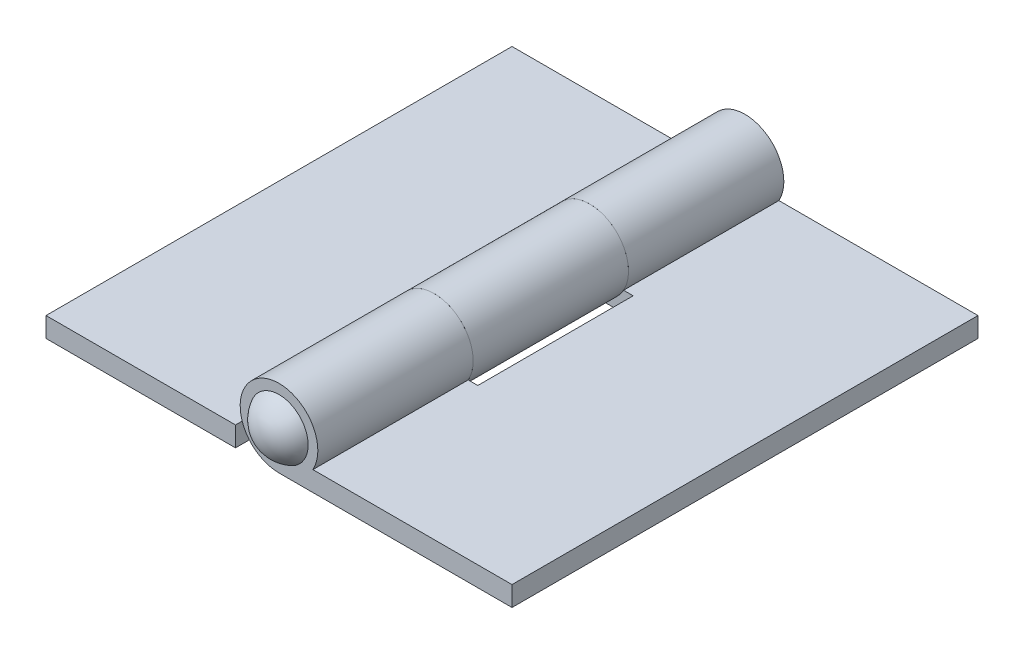
from build123d import *

# Parameters (mm, degrees)
SKETCH1_R           = 1.5875
EXTRUDE1_DEPTH      = 19.05
SKETCH1_W           = 15.494
SKETCH1_H           = 1.6256
EXTRUDE1_2_DEPTH    = 19.05
EXTRUDE4_DEPTH      = 29.173887468
EXTRUDE4_DEPTH_BACK = 29.173887468
SKETCH8_W           = 7.112
SKETCH8_H           = 12.7
SKETCH9_R           = 1.5875
EXTRUDE5_DEPTH      = 12.7


with BuildPart() as part:
    # Sketch1 → Extrude1 (new, symmetric)
    with BuildSketch(Plane.XY):
        with BuildLine():
            Line((19.05, -3.175), (0, -3.175))
            ThreePointArc((0, -3.175), (-1.606437051, 2.738610049), (2.771278521, -1.5494))
            Line((2.771278521, -1.5494), (19.05, -1.5494))
            Line((19.05, -1.5494), (19.05, -3.175))
        make_face()
        with Locations(Location((0, 0, 0), (0, 0, 180))):
            Circle(SKETCH1_R, mode=Mode.SUBTRACT)
    extrude(amount=EXTRUDE1_DEPTH, both=True)

    # Sketch8 → Extrude4 (cut, two sides: drawn at the far end of the back side and taken through both)
    with BuildSketch(Plane(origin=(0, 0, 0), x_dir=(1, 0, 0), z_dir=(0, 1, 0)).offset(-EXTRUDE4_DEPTH_BACK)):
        Rectangle(SKETCH8_W, SKETCH8_H)
    extrude(amount=EXTRUDE4_DEPTH + EXTRUDE4_DEPTH_BACK, mode=Mode.SUBTRACT)


with BuildPart() as body_2:
    # Sketch1 → Extrude1 2 (new, symmetric)
    with BuildSketch(Plane.XY):
        with Locations((-11.303, -2.3622)):
            Rectangle(SKETCH1_W, SKETCH1_H)
    extrude(amount=EXTRUDE1_2_DEPTH, both=True)

    # Sketch9 → Extrude5 (add)
    with BuildSketch(Plane.XY.offset(-6.35)):
        with BuildLine():
            Line((-2.771278521, -1.5494), (-3.556, -1.5494))
            Line((-3.556, -1.5494), (-3.556, -3.175))
            Line((-3.556, -3.175), (0, -3.175))
            ThreePointArc((0, -3.175), (1.606437051, 2.738610049), (-2.771278521, -1.5494))
        make_face()
        with Locations(Location((0, 0, 0), (0, 0, 180))):
            Circle(SKETCH9_R, mode=Mode.SUBTRACT)
    extrude(amount=EXTRUDE5_DEPTH)


with BuildPart() as body_3:
    # Sketch6 → Revolve1 (revolve)
    with BuildSketch(Plane(origin=(0, 0, 0), x_dir=(1, 0, 0), z_dir=(0, 1, 0)), mode=Mode.PRIVATE) as revolve1_sk:
        with BuildLine():
            Line((-2.38125, 19.05), (-1.5875, 19.05))
            Line((-1.5875, 19.05), (-1.5875, -19.05))
            Line((-1.5875, -19.05), (-2.38125, -19.05))
            ThreePointArc((-2.38125, -19.05), (-1.397393789, -20.118057742), (0, -20.51304))
            Line((0, -20.51304), (0, 20.51304))
            ThreePointArc((0, 20.51304), (-1.397393789, 20.118057742), (-2.38125, 19.05))
        make_face()
    revolve(revolve1_sk.sketch.rotate(Axis((0, 0, -20.51304), (0, 0, 1)), 180), axis=Axis((0, 0, -20.51304), (0, 0, 1)))


solid = Compound([part.part, body_2.part, body_3.part])
